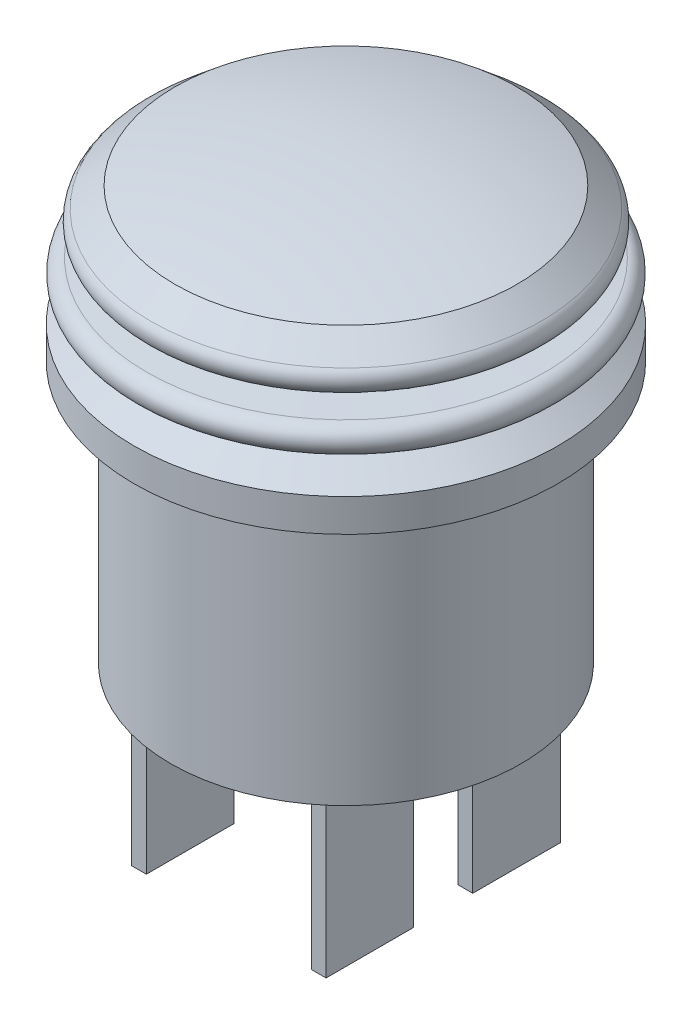
from build123d import *

# Parameters (mm, degrees)
SKETCH3_W           = 0.8
SKETCH3_H           = 4.75
BOSS_EXTRUDE1_DEPTH = 9


with BuildPart() as part:
    # Sketch1 → Revolve2 (revolve)
    with BuildSketch(Plane.XY, mode=Mode.PRIVATE) as revolve2_sk:
        with BuildLine():
            Line((0, -13.24200419), (-9.5, -13.24200419))
            Line((-9.5, -13.24200419), (-9.5, 0.9180652))
            Line((-9.5, 0.9180652), (-11.5, 0.9180652))
            Line((-11.5, 0.9180652), (-11.5, 2.69389815))
            Line((-11.5, 2.69389815), (-9.59273849, 3.99115987))
            Line((-9.59273849, 3.99115987), (-10.921099291, 4.332198136))
            ThreePointArc((-10.921099291, 4.332198136), (-11.482083746, 5.119970296), (-10.800193426, 5.805764819))
            Line((-10.800193426, 5.805764819), (-8.297971346, 6.025460413))
            Line((-8.297971346, 6.025460413), (-8.297971346, 6.184171242))
            Line((-8.297971346, 6.184171242), (-10.316863696, 6.794381901))
            ThreePointArc((-10.316863696, 6.794381901), (-10.83463658, 7.361906816), (-10.581495802, 8.087229527))
            Line((-10.581495802, 8.087229527), (-9.280818948, 9.176830883))
            Line((-9.280818948, 9.176830883), (0, 9.176830883))
            Line((0, 9.176830883), (0, -13.24200419))
        make_face()
    revolve(revolve2_sk.sketch.rotate(Axis((0, 40.42841221, 0), (0, -1, 0)), 270), axis=Axis((0, 40.42841221, 0), (0, -1, 0)))

    # Sketch2 → Revolve3 (revolve)
    with BuildSketch(Plane.XY, mode=Mode.PRIVATE) as revolve3_sk:
        with BuildLine():
            Line((0, 9.176830883), (-9.280818948, 9.176830883))
            ThreePointArc((-9.280818948, 9.176830883), (-4.681726791, 10.106381279), (0, 10.4180652))
            Line((0, 10.4180652), (0, 9.176830883))
        make_face()
    revolve(revolve3_sk.sketch.rotate(Axis((0, 15.762950143, 0), (0, -1, 0)), 270), axis=Axis((0, 15.762950143, 0), (0, -1, 0)))

    # Sketch3 → Boss-Extrude1 (add)
    with BuildSketch(Plane.XZ.offset(13.24200419)):
        with Locations((-4.875927863, 3.979511683)):
            Rectangle(SKETCH3_W, SKETCH3_H)
        with Locations((4.875927863, 3.979511683)):
            Rectangle(SKETCH3_W, SKETCH3_H)
        with Locations((4.875927863, -3.979511683)):
            Rectangle(SKETCH3_W, SKETCH3_H)
        with Locations((-4.875927863, -3.979511683)):
            Rectangle(SKETCH3_W, SKETCH3_H)
    extrude(amount=BOSS_EXTRUDE1_DEPTH)


solid = part.part
